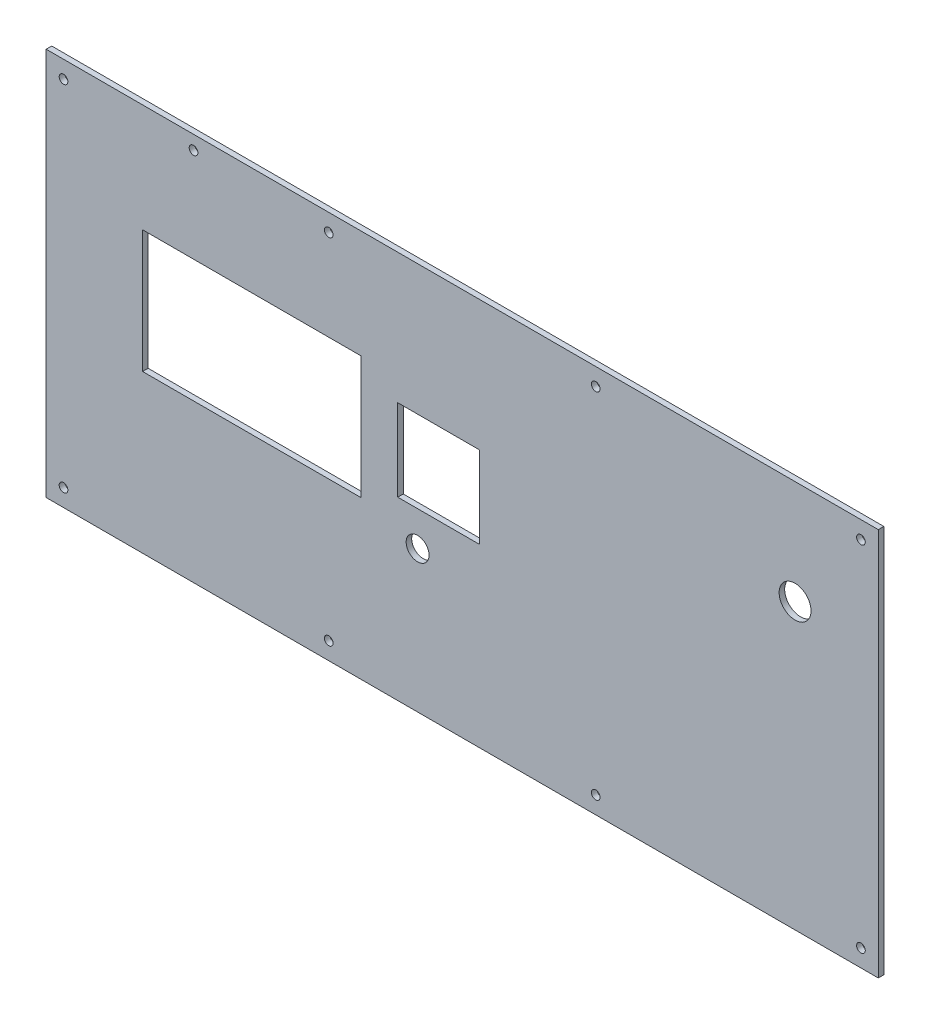
from build123d import *

# Parameters (mm, degrees)
SKETCH1_W          = 304.8
SKETCH1_H          = 142.24
EXTRUDE1_DEPTH     = 2.032
SKETCH3_R          = 1.5875
CUT_EXTRUDE1_DEPTH = 252.699806613
SKETCH4_R          = 4.191
SKETCH4_R_2        = 1.5875
SKETCH4_R_3        = 5.842
SKETCH4_W          = 80.01
SKETCH4_H          = 44.958
SKETCH4_W_2        = 29.972
SKETCH4_H_2        = 29.972
EXTRUDE2_DEPTH     = 252.699806613


with BuildPart() as part:
    # Sketch1 → Extrude1 (new body)
    with BuildSketch(Plane.XY):
        with Locations((55.245, 71.12)):
            Rectangle(SKETCH1_W, SKETCH1_H)
    extrude(amount=EXTRUDE1_DEPTH)

    # Sketch3 → Cut-Extrude1 (cut, through all)
    with BuildSketch(Plane.XY.offset(2.032)):
        with Locations((-90.805, 135.89)):
            Circle(SKETCH3_R)
        with Locations((-90.805, 6.35)):
            Circle(SKETCH3_R)
        with Locations((6.35, 135.89)):
            Circle(SKETCH3_R)
        with Locations((6.35, 6.35)):
            Circle(SKETCH3_R)
        with Locations(Location((104.14, 6.35, 0), (0, 0, 180))):
            Circle(SKETCH3_R)
        with Locations(Location((104.14, 135.89, 0), (0, 0, 180))):
            Circle(SKETCH3_R)
        with Locations(Location((201.295, 6.35, 0), (0, 0, 180))):
            Circle(SKETCH3_R)
        with Locations(Location((201.295, 135.89, 0), (0, 0, 180))):
            Circle(SKETCH3_R)
    extrude(amount=-CUT_EXTRUDE1_DEPTH, mode=Mode.SUBTRACT)

    # Sketch4 → Extrude2 (cut, through all)
    with BuildSketch(Plane.XY.offset(2.032)):
        with Locations((38.895, 51.84)):
            Circle(SKETCH4_R)
        with Locations((-43.18, 137.16)):
            Circle(SKETCH4_R_2)
        with Locations((177.165, 104.14)):
            Circle(SKETCH4_R_3)
        with Locations((-21.844, 80.137)):
            Rectangle(SKETCH4_W, SKETCH4_H)
        with Locations((46.609, 79.502)):
            Rectangle(SKETCH4_W_2, SKETCH4_H_2)
    extrude(amount=-EXTRUDE2_DEPTH, mode=Mode.SUBTRACT)


solid = part.part
